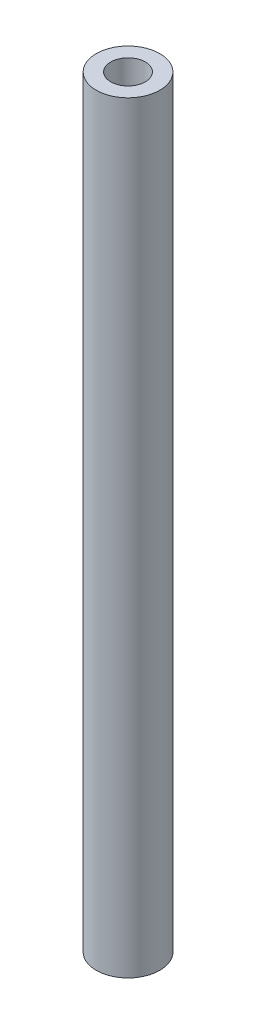
from build123d import *

# Parameters (mm, degrees)
SKETCH1_R                 = 3.175
BOSS_EXTRUDE1_DEPTH       = 76.2
F_8_32_TAPPED_HOLE1_D     = 3.4544
F_8_32_TAPPED_HOLE1_DEPTH = 10
F_8_32_TAPPED_HOLE1_TIP   = 1.037806461
F_8_32_TAPPED_HOLE2_D     = 3.4544
F_8_32_TAPPED_HOLE2_DEPTH = 10
F_8_32_TAPPED_HOLE2_TIP   = 1.037806461


with BuildPart() as part:
    # Sketch1 → Boss-Extrude1 (new body)
    with BuildSketch(Plane(origin=(0, 0, 0), x_dir=(1, 0, 0), z_dir=(0, 1, 0))):
        with Locations(Location((0, 0, 0), (0, 0, 90))):
            Circle(SKETCH1_R)
    extrude(amount=BOSS_EXTRUDE1_DEPTH)

    # #8-32 Tapped Hole1
    with Locations(Plane(origin=(0, 76.2, 0), x_dir=(1, 0, 0), z_dir=(0, 1, 0))):
        with Locations((0, 0)):
            Hole(F_8_32_TAPPED_HOLE1_D / 2, depth=F_8_32_TAPPED_HOLE1_DEPTH)
            with Locations((0, 0, -(F_8_32_TAPPED_HOLE1_DEPTH + F_8_32_TAPPED_HOLE1_TIP / 2))):  # 118° drill point
                Cone(0, F_8_32_TAPPED_HOLE1_D / 2, F_8_32_TAPPED_HOLE1_TIP, mode=Mode.SUBTRACT)

    # #8-32 Tapped Hole2
    with Locations(Plane(origin=(0, 0, 0), x_dir=(-1, 0, 0), z_dir=(0, -1, 0))):
        with Locations((0, 0)):
            Hole(F_8_32_TAPPED_HOLE2_D / 2, depth=F_8_32_TAPPED_HOLE2_DEPTH)
            with Locations((0, 0, -(F_8_32_TAPPED_HOLE2_DEPTH + F_8_32_TAPPED_HOLE2_TIP / 2))):  # 118° drill point
                Cone(0, F_8_32_TAPPED_HOLE2_D / 2, F_8_32_TAPPED_HOLE2_TIP, mode=Mode.SUBTRACT)


solid = part.part
